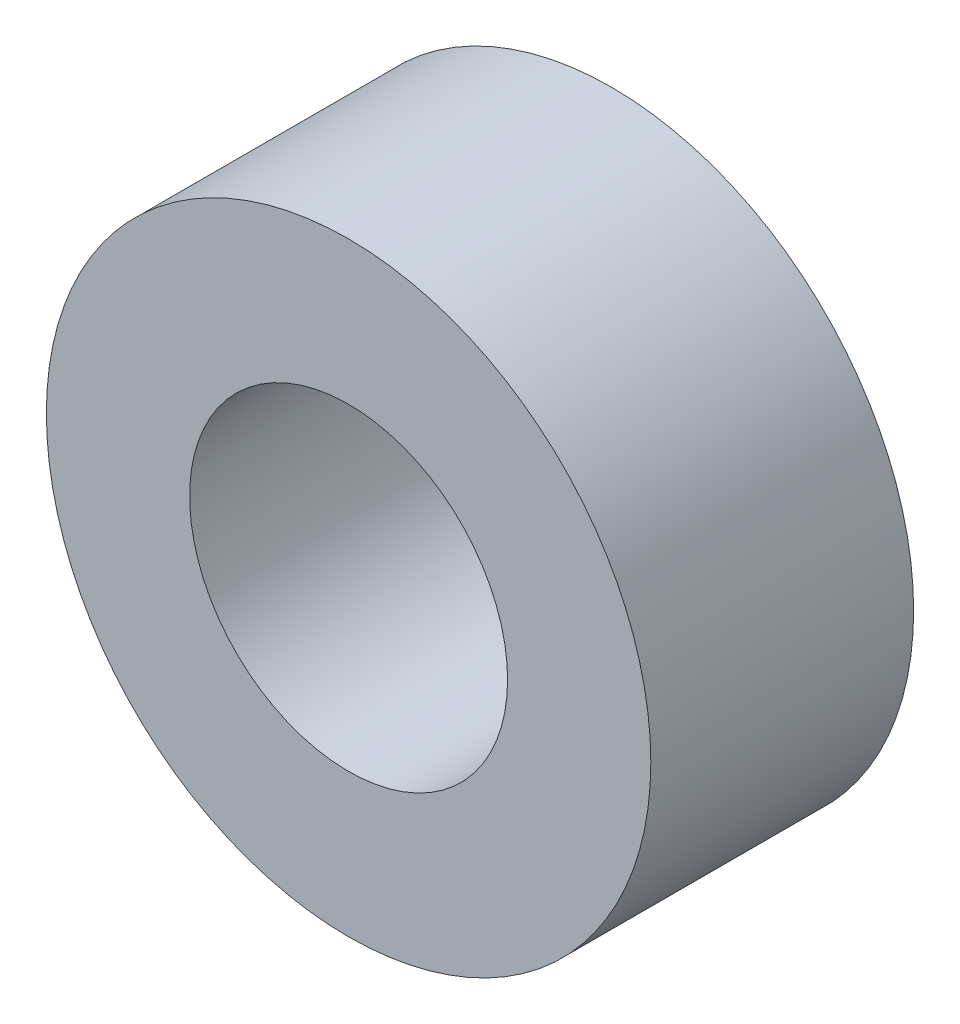
from build123d import *

# Parameters (mm, degrees)
SKETCH1_R           = 5.75
BOSS_EXTRUDE1_DEPTH = 5
SKETCH2_R           = 3.025
CUT_EXTRUDE1_DEPTH  = 4.8


with BuildPart() as part:
    # Sketch1 → Boss-Extrude1 (new body)
    with BuildSketch(Plane.XY):
        Circle(SKETCH1_R)
    extrude(amount=BOSS_EXTRUDE1_DEPTH)

    # Sketch2 → Cut-Extrude1 (cut)
    with BuildSketch(Plane.XY.offset(5)):
        Circle(SKETCH2_R)
    extrude(amount=-CUT_EXTRUDE1_DEPTH, mode=Mode.SUBTRACT)


solid = part.part
